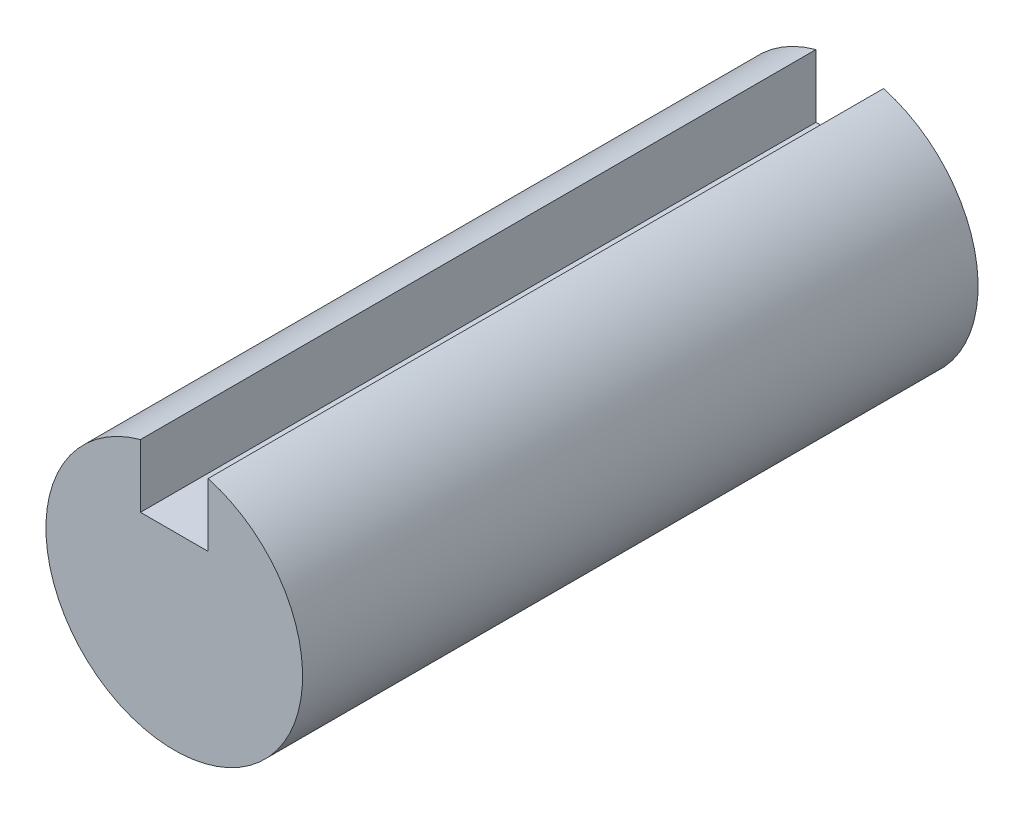
from build123d import *

# Parameters (mm, degrees)
SKETCH1_R           = 9.5
BOSS_EXTRUDE1_DEPTH = 50
SKETCH2_W           = 5
SKETCH2_H           = 10
CUT_EXTRUDE1_DEPTH  = 52.773545368


with BuildPart() as part:
    # Sketch1 → Boss-Extrude1 (new body)
    with BuildSketch(Plane.XY):
        Circle(SKETCH1_R)
    extrude(amount=BOSS_EXTRUDE1_DEPTH)

    # Sketch2 → Cut-Extrude1 (cut, through all)
    with BuildSketch(Plane.XY.offset(50)):
        with Locations((0, 9.5)):
            Rectangle(SKETCH2_W, SKETCH2_H)
    extrude(amount=-CUT_EXTRUDE1_DEPTH, mode=Mode.SUBTRACT)


solid = part.part
